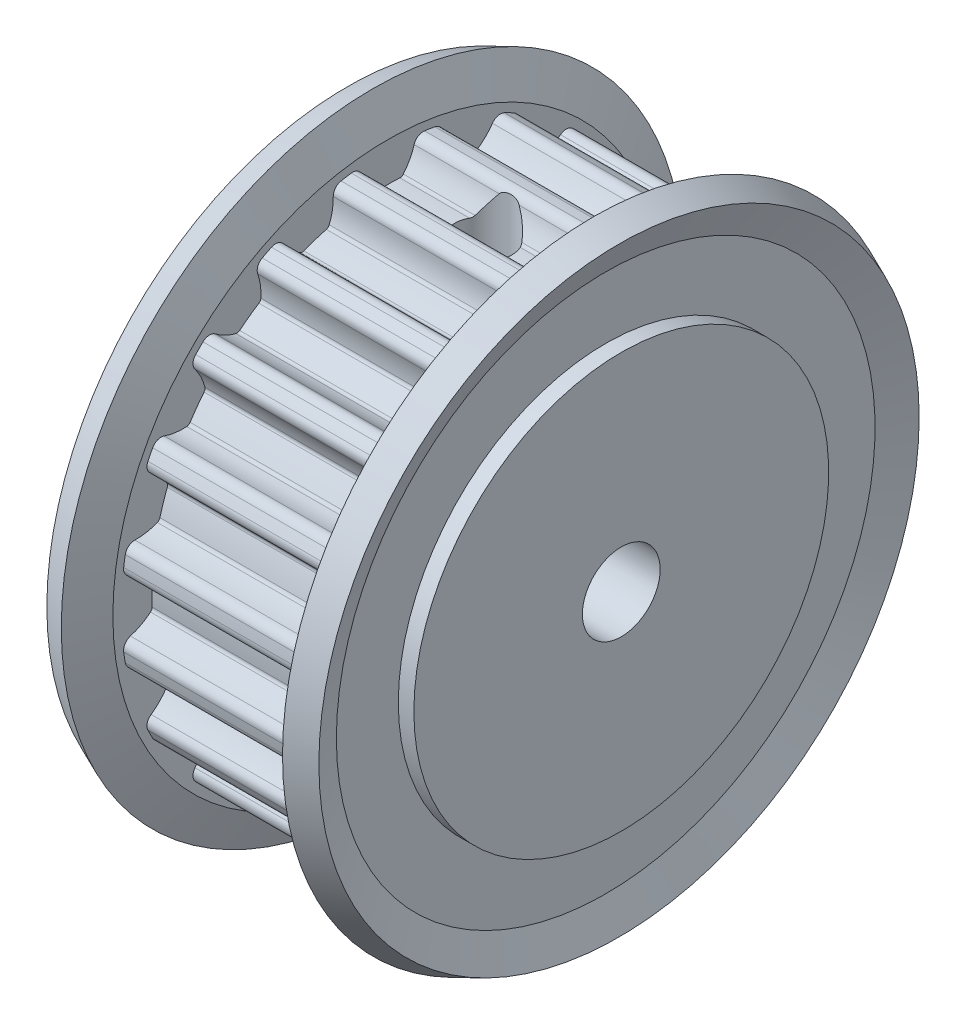
from build123d import *

# Parameters (mm, degrees)
SKETCH_2_W           = 16
SKETCH_2_H           = 18
CUT_EXTRUDE_1_DEPTH  = 11
CUT_EXTRUDE_2_DEPTH  = 11
CUT_EXTRUDE_3_DEPTH  = 11
CUT_EXTRUDE_4_DEPTH  = 11
CUT_EXTRUDE_5_DEPTH  = 11
CUT_EXTRUDE_6_DEPTH  = 11
CUT_EXTRUDE_7_DEPTH  = 11
CUT_EXTRUDE_8_DEPTH  = 11
CUT_EXTRUDE_9_DEPTH  = 11
CUT_EXTRUDE_10_DEPTH = 11
CUT_EXTRUDE_11_DEPTH = 11
CUT_EXTRUDE_12_DEPTH = 11
CUT_EXTRUDE_13_DEPTH = 11
CUT_EXTRUDE_14_DEPTH = 11
CUT_EXTRUDE_15_DEPTH = 11
CUT_EXTRUDE_16_DEPTH = 11
CUT_EXTRUDE_17_DEPTH = 11
CUT_EXTRUDE_18_DEPTH = 11
CUT_EXTRUDE_19_DEPTH = 11
CUT_EXTRUDE_20_DEPTH = 11
SKETCH_24_W          = 1.621
SKETCH_24_H          = 12.76


with BuildPart() as part:
    # 草图1 → 旋转1 (revolve)
    with BuildSketch(Plane.XY):
        Polygon((0, 12), (0, 2.25), (28, 2.25), (28, 4.175), (16, 4.175), (16, 12), (15.1, 12), (15.1, 15.584417878), (15.868987169, 17.365904819), (14.4, 18), (13.5, 15.915), (13.5, 15.435), (2.5, 15.435), (2.5, 15.915), (1.6, 18), (0.131012831, 17.365904819), (0.9, 15.584417878), (0.9, 12), align=None)
    revolve(axis=Axis((28, 0, 0), (-1, 0, 0)))

    # 草图2 → 切除-旋转1 (revolve, cut)
    with BuildSketch(Plane.XY):
        with Locations((24, 9)):
            Rectangle(SKETCH_2_W, SKETCH_2_H)
    revolve(axis=Axis((32, 0, 0), (-1, 0, 0)), mode=Mode.SUBTRACT)

    # 草图3 → 切除-拉伸1 (cut)
    with BuildSketch(Plane(origin=(2.5, 0, 0), x_dir=(0, 0, -1), z_dir=(1, 0, 0))):
        with BuildLine():
            Line((2.117582594, 15.289050623), (2.117582594, 20.58))
            Line((2.117582594, 20.58), (-2.117582594, 20.58))
            Line((-2.117582594, 20.58), (-2.117582594, 15.289050623))
            ThreePointArc((-2.117582594, 15.289050623), (-1.744204447, 15.206574401), (-1.514826938, 14.900634005))
            ThreePointArc((-1.514826938, 14.900634005), (-1.262981105, 14.287416305), (-0.892805689, 13.737477734))
            ThreePointArc((-0.892805689, 13.737477734), (-0.801013519, 13.668400532), (-0.688019523, 13.647668451))
            ThreePointArc((-0.688019523, 13.647668451), (0, 13.665), (0.688019523, 13.647668451))
            ThreePointArc((0.688019523, 13.647668451), (0.801013545, 13.668400543), (0.892805724, 13.737477777))
            ThreePointArc((0.892805724, 13.737477777), (1.26298113, 14.287416352), (1.514826953, 14.900634054))
            ThreePointArc((1.514826953, 14.900634054), (1.744204469, 15.206574415), (2.117582594, 15.289050623))
        make_face()
    extrude(amount=CUT_EXTRUDE_1_DEPTH, mode=Mode.SUBTRACT)

    # 草图5 → 切除-拉伸2 (cut)
    with BuildSketch(Plane(origin=(2.5, 0, 0), x_dir=(0, 0, -1), z_dir=(1, 0, 0))):
        with BuildLine():
            Line((-2.710635746, 15.195120232), (-4.34562902, 20.227112114))
            Line((-4.34562902, 20.227112114), (-8.373510469, 18.918374097))
            Line((-8.373510469, 18.918374097), (-6.738517195, 13.886382215))
            ThreePointArc((-6.738517195, 13.886382215), (-6.357926921, 13.923322859), (-6.045235165, 13.7032378))
            ThreePointArc((-6.045235165, 13.7032378), (-5.616220854, 13.197857753), (-5.094222748, 12.789225586))
            ThreePointArc((-5.094222748, 12.789225586), (-4.985577177, 12.751894603), (-4.871706936, 12.767094287))
            ThreePointArc((-4.871706936, 12.767094287), (-4.222717228, 12.996187295), (-3.563016034, 13.192313737))
            ThreePointArc((-3.563016034, 13.192313737), (-3.461958902, 13.246948202), (-3.396005391, 13.341009898))
            ThreePointArc((-3.396005391, 13.341009898), (-3.213888025, 13.978423056), (-3.163863105, 14.639452386))
            ThreePointArc((-3.163863105, 14.639452386), (-3.040252895, 15.001300511), (-2.710635746, 15.195120232))
        make_face()
    extrude(amount=CUT_EXTRUDE_2_DEPTH, mode=Mode.SUBTRACT)

    # 草图6 → 切除-拉伸3 (cut)
    with BuildSketch(Plane(origin=(2.5, 0, 0), x_dir=(0, 0, -1), z_dir=(1, 0, 0))):
        with BuildLine():
            Line((-7.273518173, 13.613785601), (-10.383460187, 17.894253563))
            Line((-10.383460187, 17.894253563), (-13.809780797, 15.404885925))
            Line((-13.809780797, 15.404885925), (-10.699838783, 11.124417963))
            ThreePointArc((-10.699838783, 11.124417963), (-10.34929121, 11.277159466), (-9.983893654, 11.164473203))
            ThreePointArc((-9.983893654, 11.164473203), (-9.419705775, 10.816400929), (-8.796981791, 10.58907493))
            ThreePointArc((-8.796981791, 10.58907493), (-8.682117805, 10.587144383), (-8.57851773, 10.636787981))
            ThreePointArc((-8.57851773, 10.636787981), (-8.032085473, 11.055217228), (-7.465278757, 11.445603439))
            ThreePointArc((-7.465278757, 11.445603439), (-7.386050691, 11.528792273), (-7.352391837, 11.638631019))
            ThreePointArc((-7.352391837, 11.638631019), (-7.376159427, 12.301124317), (-7.532852198, 12.94525912))
            ThreePointArc((-7.532852198, 12.94525912), (-7.527109122, 13.327594792), (-7.273518173, 13.613785601))
        make_face()
    extrude(amount=CUT_EXTRUDE_3_DEPTH, mode=Mode.SUBTRACT)

    # 草图7 → 切除-拉伸4 (cut)
    with BuildSketch(Plane(origin=(2.5, 0, 0), x_dir=(0, 0, -1), z_dir=(1, 0, 0))):
        with BuildLine():
            Line((-11.124417963, 10.699838783), (-15.404885925, 13.809780797))
            Line((-15.404885925, 13.809780797), (-17.894253563, 10.383460187))
            Line((-17.894253563, 10.383460187), (-13.613785601, 7.273518173))
            ThreePointArc((-13.613785601, 7.273518173), (-13.327594768, 7.527109132), (-12.945259071, 7.532852181))
            ThreePointArc((-12.945259071, 7.532852181), (-12.301124264, 7.37615942), (-11.638630964, 7.352391841))
            ThreePointArc((-11.638630964, 7.352391841), (-11.528792249, 7.386050705), (-11.445603439, 7.465278757))
            ThreePointArc((-11.445603439, 7.465278757), (-11.055217228, 8.032085473), (-10.636787981, 8.57851773))
            ThreePointArc((-10.636787981, 8.57851773), (-10.587144377, 8.682117832), (-10.589074943, 8.796981844))
            ThreePointArc((-10.589074943, 8.796981844), (-10.816400952, 9.419705823), (-11.164473234, 9.983893695))
            ThreePointArc((-11.164473234, 9.983893695), (-11.277159464, 10.349291236), (-11.124417963, 10.699838783))
        make_face()
    extrude(amount=CUT_EXTRUDE_4_DEPTH, mode=Mode.SUBTRACT)

    # 草图8 → 切除-拉伸5 (cut)
    with BuildSketch(Plane(origin=(2.5, 0, 0), x_dir=(0, 0, -1), z_dir=(1, 0, 0))):
        with BuildLine():
            Line((-13.886382215, 6.738517195), (-18.918374097, 8.373510469))
            Line((-18.918374097, 8.373510469), (-20.227112114, 4.34562902))
            Line((-20.227112114, 4.34562902), (-15.195120232, 2.710635746))
            ThreePointArc((-15.195120232, 2.710635746), (-15.001300491, 3.040252911), (-14.639452335, 3.163863104))
            ThreePointArc((-14.639452335, 3.163863104), (-13.978423003, 3.213888034), (-13.341009847, 3.396005412))
            ThreePointArc((-13.341009847, 3.396005412), (-13.246948183, 3.461958923), (-13.192313737, 3.563016034))
            ThreePointArc((-13.192313737, 3.563016034), (-12.996187295, 4.222717228), (-12.767094287, 4.871706936))
            ThreePointArc((-12.767094287, 4.871706936), (-12.751894606, 4.985577205), (-12.789225615, 5.094222795))
            ThreePointArc((-12.789225615, 5.094222795), (-13.19785779, 5.616220893), (-13.703237842, 6.045235194))
            ThreePointArc((-13.703237842, 6.045235194), (-13.923322866, 6.357926946), (-13.886382215, 6.738517195))
        make_face()
    extrude(amount=CUT_EXTRUDE_5_DEPTH, mode=Mode.SUBTRACT)

    # 草图9 → 切除-拉伸6 (cut)
    with BuildSketch(Plane(origin=(2.5, 0, 0), x_dir=(0, 0, -1), z_dir=(1, 0, 0))):
        with BuildLine():
            Line((-15.289050623, 2.117582594), (-20.58, 2.117582594))
            Line((-20.58, 2.117582594), (-20.58, -2.117582594))
            Line((-20.58, -2.117582594), (-15.289050623, -2.117582594))
            ThreePointArc((-15.289050623, -2.117582594), (-15.206574401, -1.744204447), (-14.900634005, -1.514826938))
            ThreePointArc((-14.900634005, -1.514826938), (-14.287416305, -1.262981105), (-13.737477734, -0.892805689))
            ThreePointArc((-13.737477734, -0.892805689), (-13.668400532, -0.801013519), (-13.647668451, -0.688019523))
            ThreePointArc((-13.647668451, -0.688019523), (-13.665, 0), (-13.647668451, 0.688019523))
            ThreePointArc((-13.647668451, 0.688019523), (-13.668400543, 0.801013545), (-13.737477777, 0.892805724))
            ThreePointArc((-13.737477777, 0.892805724), (-14.287416352, 1.26298113), (-14.900634054, 1.514826953))
            ThreePointArc((-14.900634054, 1.514826953), (-15.206574415, 1.744204469), (-15.289050623, 2.117582594))
        make_face()
    extrude(amount=CUT_EXTRUDE_6_DEPTH, mode=Mode.SUBTRACT)

    # 草图10 → 切除-拉伸7 (cut)
    with BuildSketch(Plane(origin=(2.5, 0, 0), x_dir=(0, 0, -1), z_dir=(1, 0, 0))):
        with BuildLine():
            Line((-15.195120232, -2.710635746), (-20.227112114, -4.34562902))
            Line((-20.227112114, -4.34562902), (-18.918374097, -8.373510469))
            Line((-18.918374097, -8.373510469), (-13.886382215, -6.738517195))
            ThreePointArc((-13.886382215, -6.738517195), (-13.923322859, -6.357926921), (-13.7032378, -6.045235165))
            ThreePointArc((-13.7032378, -6.045235165), (-13.197857753, -5.616220854), (-12.789225586, -5.094222748))
            ThreePointArc((-12.789225586, -5.094222748), (-12.751894603, -4.985577177), (-12.767094287, -4.871706936))
            ThreePointArc((-12.767094287, -4.871706936), (-12.996187295, -4.222717228), (-13.192313737, -3.563016034))
            ThreePointArc((-13.192313737, -3.563016034), (-13.246948202, -3.461958902), (-13.341009898, -3.396005391))
            ThreePointArc((-13.341009898, -3.396005391), (-13.978423056, -3.213888025), (-14.639452386, -3.163863105))
            ThreePointArc((-14.639452386, -3.163863105), (-15.001300511, -3.040252895), (-15.195120232, -2.710635746))
        make_face()
    extrude(amount=CUT_EXTRUDE_7_DEPTH, mode=Mode.SUBTRACT)

    # 草图11 → 切除-拉伸8 (cut)
    with BuildSketch(Plane(origin=(2.5, 0, 0), x_dir=(0, 0, -1), z_dir=(1, 0, 0))):
        with BuildLine():
            Line((-13.613785601, -7.273518173), (-17.894253563, -10.383460187))
            Line((-17.894253563, -10.383460187), (-15.404885925, -13.809780797))
            Line((-15.404885925, -13.809780797), (-11.124417963, -10.699838783))
            ThreePointArc((-11.124417963, -10.699838783), (-11.277159466, -10.34929121), (-11.164473203, -9.983893654))
            ThreePointArc((-11.164473203, -9.983893654), (-10.816400929, -9.419705775), (-10.58907493, -8.796981791))
            ThreePointArc((-10.58907493, -8.796981791), (-10.587144383, -8.682117805), (-10.636787981, -8.57851773))
            ThreePointArc((-10.636787981, -8.57851773), (-11.055217228, -8.032085473), (-11.445603439, -7.465278757))
            ThreePointArc((-11.445603439, -7.465278757), (-11.528792273, -7.386050691), (-11.638631019, -7.352391837))
            ThreePointArc((-11.638631019, -7.352391837), (-12.301124317, -7.376159427), (-12.94525912, -7.532852198))
            ThreePointArc((-12.94525912, -7.532852198), (-13.327594792, -7.527109122), (-13.613785601, -7.273518173))
        make_face()
    extrude(amount=CUT_EXTRUDE_8_DEPTH, mode=Mode.SUBTRACT)

    # 草图12 → 切除-拉伸9 (cut)
    with BuildSketch(Plane(origin=(2.5, 0, 0), x_dir=(0, 0, -1), z_dir=(1, 0, 0))):
        with BuildLine():
            Line((-10.699838783, -11.124417963), (-13.809780797, -15.404885925))
            Line((-13.809780797, -15.404885925), (-10.383460187, -17.894253563))
            Line((-10.383460187, -17.894253563), (-7.273518173, -13.613785601))
            ThreePointArc((-7.273518173, -13.613785601), (-7.527109132, -13.327594768), (-7.532852181, -12.945259071))
            ThreePointArc((-7.532852181, -12.945259071), (-7.37615942, -12.301124264), (-7.352391841, -11.638630964))
            ThreePointArc((-7.352391841, -11.638630964), (-7.386050705, -11.528792249), (-7.465278757, -11.445603439))
            ThreePointArc((-7.465278757, -11.445603439), (-8.032085473, -11.055217228), (-8.57851773, -10.636787981))
            ThreePointArc((-8.57851773, -10.636787981), (-8.682117832, -10.587144377), (-8.796981844, -10.589074943))
            ThreePointArc((-8.796981844, -10.589074943), (-9.419705823, -10.816400952), (-9.983893695, -11.164473234))
            ThreePointArc((-9.983893695, -11.164473234), (-10.349291236, -11.277159464), (-10.699838783, -11.124417963))
        make_face()
    extrude(amount=CUT_EXTRUDE_9_DEPTH, mode=Mode.SUBTRACT)

    # 草图13 → 切除-拉伸10 (cut)
    with BuildSketch(Plane(origin=(2.5, 0, 0), x_dir=(0, 0, -1), z_dir=(1, 0, 0))):
        with BuildLine():
            Line((-6.738517195, -13.886382215), (-8.373510469, -18.918374097))
            Line((-8.373510469, -18.918374097), (-4.34562902, -20.227112114))
            Line((-4.34562902, -20.227112114), (-2.710635746, -15.195120232))
            ThreePointArc((-2.710635746, -15.195120232), (-3.040252911, -15.001300491), (-3.163863104, -14.639452335))
            ThreePointArc((-3.163863104, -14.639452335), (-3.213888034, -13.978423003), (-3.396005412, -13.341009847))
            ThreePointArc((-3.396005412, -13.341009847), (-3.461958923, -13.246948183), (-3.563016034, -13.192313737))
            ThreePointArc((-3.563016034, -13.192313737), (-4.222717228, -12.996187295), (-4.871706936, -12.767094287))
            ThreePointArc((-4.871706936, -12.767094287), (-4.985577205, -12.751894606), (-5.094222795, -12.789225615))
            ThreePointArc((-5.094222795, -12.789225615), (-5.616220893, -13.19785779), (-6.045235194, -13.703237842))
            ThreePointArc((-6.045235194, -13.703237842), (-6.357926946, -13.923322866), (-6.738517195, -13.886382215))
        make_face()
    extrude(amount=CUT_EXTRUDE_10_DEPTH, mode=Mode.SUBTRACT)

    # 草图14 → 切除-拉伸11 (cut)
    with BuildSketch(Plane(origin=(2.5, 0, 0), x_dir=(0, 0, -1), z_dir=(1, 0, 0))):
        with BuildLine():
            Line((-2.117582618, -15.289050592), (-2.117582697, -20.579999968))
            Line((-2.117582697, -20.579999968), (2.117582491, -20.580000032))
            Line((2.117582491, -20.580000032), (2.117582569, -15.289050655))
            ThreePointArc((2.117582569, -15.289050655), (1.744204424, -15.206574427), (1.51482692, -14.900634027))
            ThreePointArc((1.51482692, -14.900634027), (1.262981096, -14.287416324), (0.892805688, -13.737477747))
            ThreePointArc((0.892805688, -13.737477747), (0.801013519, -13.668400544), (0.688019523, -13.647668461))
            ThreePointArc((0.688019523, -13.647668461), (0, -13.665), (-0.688019523, -13.64766844))
            ThreePointArc((-0.688019523, -13.64766844), (-0.801013545, -13.668400531), (-0.892805725, -13.737477763))
            ThreePointArc((-0.892805725, -13.737477763), (-1.26298114, -14.287416333), (-1.514826971, -14.900634032))
            ThreePointArc((-1.514826971, -14.900634032), (-1.744204492, -15.206574389), (-2.117582618, -15.289050592))
        make_face()
    extrude(amount=CUT_EXTRUDE_11_DEPTH, mode=Mode.SUBTRACT)

    # 草图15 → 切除-拉伸12 (cut)
    with BuildSketch(Plane(origin=(2.5, 0, 0), x_dir=(0, 0, -1), z_dir=(1, 0, 0))):
        with BuildLine():
            Line((2.710635746, -15.195120232), (4.34562902, -20.227112114))
            Line((4.34562902, -20.227112114), (8.373510469, -18.918374097))
            Line((8.373510469, -18.918374097), (6.738517195, -13.886382215))
            ThreePointArc((6.738517195, -13.886382215), (6.357926921, -13.923322859), (6.045235165, -13.7032378))
            ThreePointArc((6.045235165, -13.7032378), (5.616220854, -13.197857753), (5.094222748, -12.789225586))
            ThreePointArc((5.094222748, -12.789225586), (4.985577177, -12.751894603), (4.871706936, -12.767094287))
            ThreePointArc((4.871706936, -12.767094287), (4.222717228, -12.996187295), (3.563016034, -13.192313737))
            ThreePointArc((3.563016034, -13.192313737), (3.461958902, -13.246948202), (3.396005391, -13.341009898))
            ThreePointArc((3.396005391, -13.341009898), (3.213888025, -13.978423056), (3.163863105, -14.639452386))
            ThreePointArc((3.163863105, -14.639452386), (3.040252895, -15.001300511), (2.710635746, -15.195120232))
        make_face()
    extrude(amount=CUT_EXTRUDE_12_DEPTH, mode=Mode.SUBTRACT)

    # 草图16 → 切除-拉伸13 (cut)
    with BuildSketch(Plane(origin=(2.5, 0, 0), x_dir=(0, 0, -1), z_dir=(1, 0, 0))):
        with BuildLine():
            Line((7.273518173, -13.613785601), (10.383460187, -17.894253563))
            Line((10.383460187, -17.894253563), (13.809780797, -15.404885925))
            Line((13.809780797, -15.404885925), (10.699838783, -11.124417963))
            ThreePointArc((10.699838783, -11.124417963), (10.34929121, -11.277159466), (9.983893654, -11.164473203))
            ThreePointArc((9.983893654, -11.164473203), (9.419705775, -10.816400929), (8.796981791, -10.58907493))
            ThreePointArc((8.796981791, -10.58907493), (8.682117805, -10.587144383), (8.57851773, -10.636787981))
            ThreePointArc((8.57851773, -10.636787981), (8.032085473, -11.055217228), (7.465278757, -11.445603439))
            ThreePointArc((7.465278757, -11.445603439), (7.386050691, -11.528792273), (7.352391837, -11.638631019))
            ThreePointArc((7.352391837, -11.638631019), (7.376159427, -12.301124317), (7.532852198, -12.94525912))
            ThreePointArc((7.532852198, -12.94525912), (7.527109122, -13.327594792), (7.273518173, -13.613785601))
        make_face()
    extrude(amount=CUT_EXTRUDE_13_DEPTH, mode=Mode.SUBTRACT)

    # 草图17 → 切除-拉伸14 (cut)
    with BuildSketch(Plane(origin=(2.5, 0, 0), x_dir=(0, 0, -1), z_dir=(1, 0, 0))):
        with BuildLine():
            Line((11.124417963, -10.699838783), (15.404885925, -13.809780797))
            Line((15.404885925, -13.809780797), (17.894253563, -10.383460187))
            Line((17.894253563, -10.383460187), (13.613785601, -7.273518173))
            ThreePointArc((13.613785601, -7.273518173), (13.327594768, -7.527109132), (12.945259071, -7.532852181))
            ThreePointArc((12.945259071, -7.532852181), (12.301124264, -7.37615942), (11.638630964, -7.352391841))
            ThreePointArc((11.638630964, -7.352391841), (11.528792249, -7.386050705), (11.445603439, -7.465278757))
            ThreePointArc((11.445603439, -7.465278757), (11.055217228, -8.032085473), (10.636787981, -8.57851773))
            ThreePointArc((10.636787981, -8.57851773), (10.587144377, -8.682117832), (10.589074943, -8.796981844))
            ThreePointArc((10.589074943, -8.796981844), (10.816400952, -9.419705823), (11.164473234, -9.983893695))
            ThreePointArc((11.164473234, -9.983893695), (11.277159464, -10.349291236), (11.124417963, -10.699838783))
        make_face()
    extrude(amount=CUT_EXTRUDE_14_DEPTH, mode=Mode.SUBTRACT)

    # 草图18 → 切除-拉伸15 (cut)
    with BuildSketch(Plane(origin=(2.5, 0, 0), x_dir=(0, 0, -1), z_dir=(1, 0, 0))):
        with BuildLine():
            Line((13.886382215, -6.738517195), (18.918374097, -8.373510469))
            Line((18.918374097, -8.373510469), (20.227112114, -4.34562902))
            Line((20.227112114, -4.34562902), (15.195120232, -2.710635746))
            ThreePointArc((15.195120232, -2.710635746), (15.001300491, -3.040252911), (14.639452335, -3.163863104))
            ThreePointArc((14.639452335, -3.163863104), (13.978423003, -3.213888034), (13.341009847, -3.396005412))
            ThreePointArc((13.341009847, -3.396005412), (13.246948183, -3.461958923), (13.192313737, -3.563016034))
            ThreePointArc((13.192313737, -3.563016034), (12.996187295, -4.222717228), (12.767094287, -4.871706936))
            ThreePointArc((12.767094287, -4.871706936), (12.751894606, -4.985577205), (12.789225615, -5.094222795))
            ThreePointArc((12.789225615, -5.094222795), (13.19785779, -5.616220893), (13.703237842, -6.045235194))
            ThreePointArc((13.703237842, -6.045235194), (13.923322866, -6.357926946), (13.886382215, -6.738517195))
        make_face()
    extrude(amount=CUT_EXTRUDE_15_DEPTH, mode=Mode.SUBTRACT)

    # 草图19 → 切除-拉伸16 (cut)
    with BuildSketch(Plane(origin=(2.5, 0, 0), x_dir=(0, 0, -1), z_dir=(1, 0, 0))):
        with BuildLine():
            Line((15.289050623, -2.117582594), (20.58, -2.117582594))
            Line((20.58, -2.117582594), (20.58, 2.117582594))
            Line((20.58, 2.117582594), (15.289050623, 2.117582594))
            ThreePointArc((15.289050623, 2.117582594), (15.206574401, 1.744204447), (14.900634005, 1.514826938))
            ThreePointArc((14.900634005, 1.514826938), (14.287416305, 1.262981105), (13.737477734, 0.892805689))
            ThreePointArc((13.737477734, 0.892805689), (13.668400532, 0.801013519), (13.647668451, 0.688019523))
            ThreePointArc((13.647668451, 0.688019523), (13.665, 0), (13.647668451, -0.688019523))
            ThreePointArc((13.647668451, -0.688019523), (13.668400543, -0.801013545), (13.737477777, -0.892805724))
            ThreePointArc((13.737477777, -0.892805724), (14.287416352, -1.26298113), (14.900634054, -1.514826953))
            ThreePointArc((14.900634054, -1.514826953), (15.206574415, -1.744204469), (15.289050623, -2.117582594))
        make_face()
    extrude(amount=CUT_EXTRUDE_16_DEPTH, mode=Mode.SUBTRACT)

    # 草图20 → 切除-拉伸17 (cut)
    with BuildSketch(Plane(origin=(2.5, 0, 0), x_dir=(0, 0, -1), z_dir=(1, 0, 0))):
        with BuildLine():
            Line((15.195120232, 2.710635746), (20.227112114, 4.34562902))
            Line((20.227112114, 4.34562902), (18.918374097, 8.373510469))
            Line((18.918374097, 8.373510469), (13.886382215, 6.738517195))
            ThreePointArc((13.886382215, 6.738517195), (13.923322859, 6.357926921), (13.7032378, 6.045235165))
            ThreePointArc((13.7032378, 6.045235165), (13.197857753, 5.616220854), (12.789225586, 5.094222748))
            ThreePointArc((12.789225586, 5.094222748), (12.751894603, 4.985577177), (12.767094287, 4.871706936))
            ThreePointArc((12.767094287, 4.871706936), (12.996187295, 4.222717228), (13.192313737, 3.563016034))
            ThreePointArc((13.192313737, 3.563016034), (13.246948202, 3.461958902), (13.341009898, 3.396005391))
            ThreePointArc((13.341009898, 3.396005391), (13.978423056, 3.213888025), (14.639452386, 3.163863105))
            ThreePointArc((14.639452386, 3.163863105), (15.001300511, 3.040252895), (15.195120232, 2.710635746))
        make_face()
    extrude(amount=CUT_EXTRUDE_17_DEPTH, mode=Mode.SUBTRACT)

    # 草图21 → 切除-拉伸18 (cut)
    with BuildSketch(Plane(origin=(2.5, 0, 0), x_dir=(0, 0, -1), z_dir=(1, 0, 0))):
        with BuildLine():
            Line((13.613785601, 7.273518173), (17.894253563, 10.383460187))
            Line((17.894253563, 10.383460187), (15.404885925, 13.809780797))
            Line((15.404885925, 13.809780797), (11.124417963, 10.699838783))
            ThreePointArc((11.124417963, 10.699838783), (11.277159466, 10.34929121), (11.164473203, 9.983893654))
            ThreePointArc((11.164473203, 9.983893654), (10.816400929, 9.419705775), (10.58907493, 8.796981791))
            ThreePointArc((10.58907493, 8.796981791), (10.587144383, 8.682117805), (10.636787981, 8.57851773))
            ThreePointArc((10.636787981, 8.57851773), (11.055217228, 8.032085473), (11.445603439, 7.465278757))
            ThreePointArc((11.445603439, 7.465278757), (11.528792273, 7.386050691), (11.638631019, 7.352391837))
            ThreePointArc((11.638631019, 7.352391837), (12.301124317, 7.376159427), (12.94525912, 7.532852198))
            ThreePointArc((12.94525912, 7.532852198), (13.327594792, 7.527109122), (13.613785601, 7.273518173))
        make_face()
    extrude(amount=CUT_EXTRUDE_18_DEPTH, mode=Mode.SUBTRACT)

    # 草图22 → 切除-拉伸19 (cut)
    with BuildSketch(Plane(origin=(2.5, 0, 0), x_dir=(0, 0, -1), z_dir=(1, 0, 0))):
        with BuildLine():
            Line((10.699838783, 11.124417963), (13.809780797, 15.404885925))
            Line((13.809780797, 15.404885925), (10.383460187, 17.894253563))
            Line((10.383460187, 17.894253563), (7.273518173, 13.613785601))
            ThreePointArc((7.273518173, 13.613785601), (7.527109132, 13.327594768), (7.532852181, 12.945259071))
            ThreePointArc((7.532852181, 12.945259071), (7.37615942, 12.301124264), (7.352391841, 11.638630964))
            ThreePointArc((7.352391841, 11.638630964), (7.386050705, 11.528792249), (7.465278757, 11.445603439))
            ThreePointArc((7.465278757, 11.445603439), (8.032085473, 11.055217228), (8.57851773, 10.636787981))
            ThreePointArc((8.57851773, 10.636787981), (8.682117832, 10.587144377), (8.796981844, 10.589074943))
            ThreePointArc((8.796981844, 10.589074943), (9.419705823, 10.816400952), (9.983893695, 11.164473234))
            ThreePointArc((9.983893695, 11.164473234), (10.349291236, 11.277159464), (10.699838783, 11.124417963))
        make_face()
    extrude(amount=CUT_EXTRUDE_19_DEPTH, mode=Mode.SUBTRACT)

    # 草图23 → 切除-拉伸20 (cut)
    with BuildSketch(Plane(origin=(2.5, 0, 0), x_dir=(0, 0, -1), z_dir=(1, 0, 0))):
        with BuildLine():
            Line((6.738517195, 13.886382215), (8.373510469, 18.918374097))
            Line((8.373510469, 18.918374097), (4.34562902, 20.227112114))
            Line((4.34562902, 20.227112114), (2.710635746, 15.195120232))
            ThreePointArc((2.710635746, 15.195120232), (3.040252911, 15.001300491), (3.163863104, 14.639452335))
            ThreePointArc((3.163863104, 14.639452335), (3.213888034, 13.978423003), (3.396005412, 13.341009847))
            ThreePointArc((3.396005412, 13.341009847), (3.461958923, 13.246948183), (3.563016034, 13.192313737))
            ThreePointArc((3.563016034, 13.192313737), (4.222717228, 12.996187295), (4.871706936, 12.767094287))
            ThreePointArc((4.871706936, 12.767094287), (4.985577205, 12.751894606), (5.094222795, 12.789225615))
            ThreePointArc((5.094222795, 12.789225615), (5.616220893, 13.19785779), (6.045235194, 13.703237842))
            ThreePointArc((6.045235194, 13.703237842), (6.357926946, 13.923322866), (6.738517195, 13.886382215))
        make_face()
    extrude(amount=CUT_EXTRUDE_20_DEPTH, mode=Mode.SUBTRACT)

    # 草图24 → 切除-旋转2 (revolve, cut)
    with BuildSketch(Plane(origin=(8, 0, 0), x_dir=(0, 0, -1), z_dir=(1, 0, 0))):
        with Locations((0.8105, 9.055)):
            Rectangle(SKETCH_24_W, SKETCH_24_H)
    revolve(axis=Axis((8, 2.675, 0), (0, 1, 0)), mode=Mode.SUBTRACT)

    # 草图25 → 切除-旋转3 (revolve, cut)
    with BuildSketch(Plane(origin=(8, 0, 0), x_dir=(0, 0, -1), z_dir=(1, 0, 0))):
        Polygon((12.487177308, -9.072465369), (11.534377414, -10.383881917), (-0.952799894, -1.311416548), (0, 0), align=None)
    revolve(axis=Axis((8, 0, 0), (0, -0.5877852522924729, -0.8090169943749476)), mode=Mode.SUBTRACT)


solid = part.part
